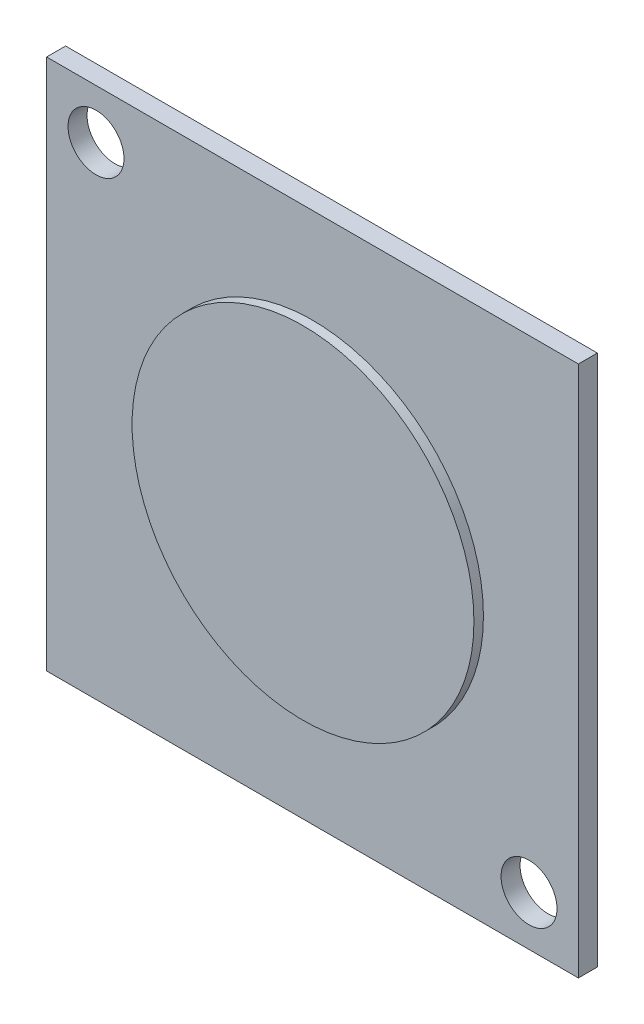
from build123d import *

# Parameters (mm, degrees)
SKETCH1_W             = 28
SKETCH1_H             = 28
BOSS_EXTRUDE1_DEPTH   = 1
SKETCH2_R             = 9
BOSS_EXTRUDE2_DEPTH   = 0.5
F_4_CLEARANCE_HOLE1_D = 2.9464


with BuildPart() as part:
    # Sketch1 → Boss-Extrude1 (new body)
    with BuildSketch(Plane.XY):
        Rectangle(SKETCH1_W, SKETCH1_H)
    extrude(amount=BOSS_EXTRUDE1_DEPTH)

    # Sketch2 → Boss-Extrude2 (add)
    with BuildSketch(Plane.XY.offset(1)):
        Circle(SKETCH2_R)
    extrude(amount=BOSS_EXTRUDE2_DEPTH)

    # #4 Clearance Hole1 (through all)
    with Locations(Plane.XY.offset(1)):
        with Locations((11.4, -11.4), (-11.4, 11.4)):
            Hole(F_4_CLEARANCE_HOLE1_D / 2)


solid = part.part
